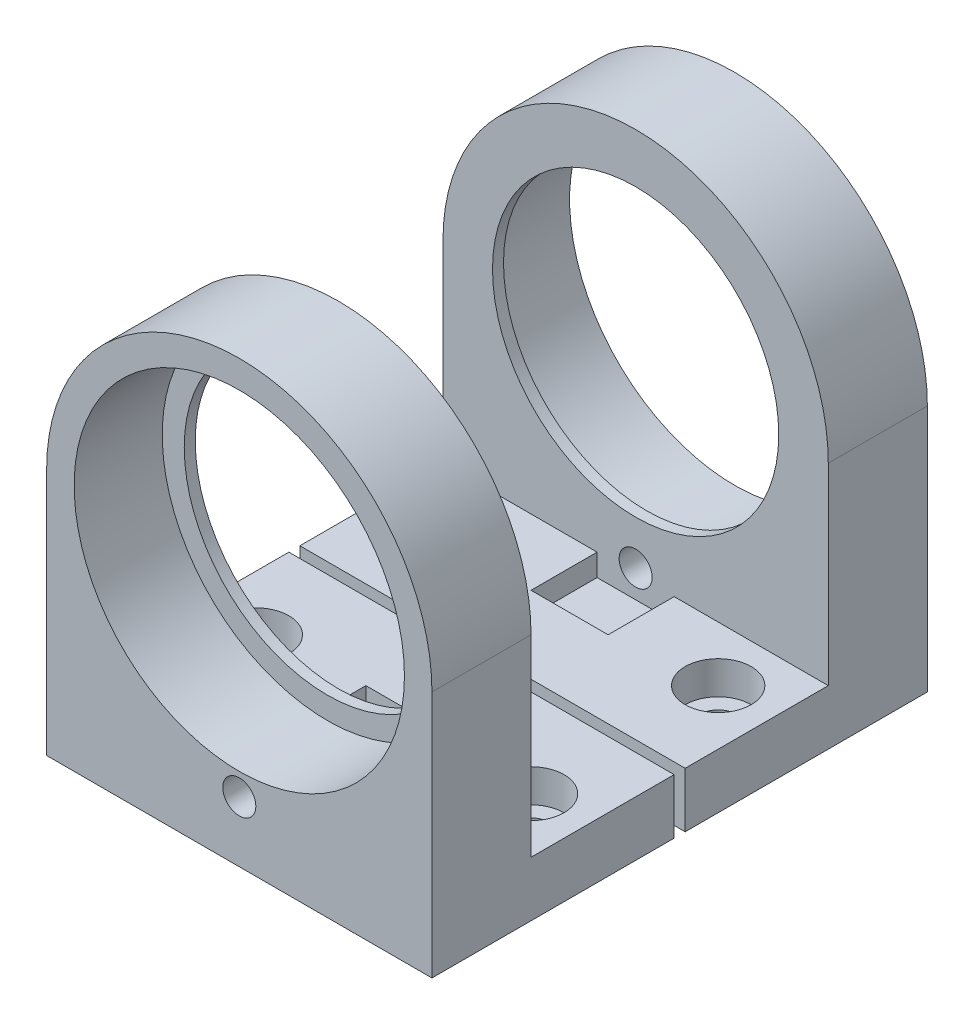
from build123d import *

# Parameters (mm, degrees)
EXTRUDE_1_DEPTH          = 17.5
CUT_EXTRUDE_1_DEPTH      = 63.69968102
CUT_EXTRUDE_1_DEPTH_BACK = 63.69968102
SKETCH_6_R               = 1.55
CUT_EXTRUDE_4_DEPTH      = 46.138675213
SKETCH_7_R               = 15
CUT_EXTRUDE_5_DEPTH      = 8
SKETCH_8_R               = 13
CUT_EXTRUDE_6_DEPTH      = 2
SKETCH_9_R               = 1.5
CUT_EXTRUDE_7_DEPTH      = 14
SKETCH_10_W              = 7
SKETCH_10_H              = 6
CUT_EXTRUDE_8_DEPTH      = 2
SKETCH_15_W              = 35
SKETCH_15_H              = 1
CUT_EXTRUDE_9_DEPTH      = 10
SKETCH_16_R              = 3
CUT_EXTRUDE_10_DEPTH     = 3


with BuildPart() as part:
    # 草图1 → 凸台-拉伸1 (new, symmetric)
    with BuildSketch(Plane(origin=(0, 0, 0), x_dir=(0, 0, -1), z_dir=(1, 0, 0))):
        Polygon((22.5, 0), (-22.5, 0), (-22.5, 40), (-13.5, 40), (-13.5, 5), (13.5, 5), (13.5, 40), (22.5, 40), align=None)
    extrude(amount=EXTRUDE_1_DEPTH, both=True)

    # 草图2 → 切除-拉伸1 (cut, two sides: drawn at the far end of the back side and taken through both)
    with BuildSketch(Plane.XY.offset(22.5).offset(-CUT_EXTRUDE_1_DEPTH_BACK)):
        with BuildLine():
            ThreePointArc((-17.5, 22.5), (-12.374368671, 34.874368671), (0, 40))
            Line((0, 40), (-17.5, 40))
            Line((-17.5, 40), (-17.5, 22.5))
        make_face()
        with BuildLine():
            Line((17.5, 22.5), (17.5, 40))
            Line((17.5, 40), (0, 40))
            ThreePointArc((0, 40), (12.374368671, 34.874368671), (17.5, 22.5))
        make_face()
    extrude(amount=CUT_EXTRUDE_1_DEPTH + CUT_EXTRUDE_1_DEPTH_BACK, mode=Mode.SUBTRACT)

    # 草图6 → 切除-拉伸4 (cut, through all)
    with BuildSketch(Plane(origin=(0, 5, 0), x_dir=(1, 0, 0), z_dir=(0, 1, 0))):
        with Locations(Location((-12.5, 8.5, 0), (0, 0, 270))):
            Circle(SKETCH_6_R)
        with Locations(Location((12.5, 8.5, 0), (0, 0, 90))):
            Circle(SKETCH_6_R)
        with Locations(Location((12.5, -8.5, 0), (0, 0, 270))):
            Circle(SKETCH_6_R)
        with Locations(Location((-12.5, -8.5, 0), (0, 0, 90))):
            Circle(SKETCH_6_R)
    extrude(amount=-CUT_EXTRUDE_4_DEPTH, mode=Mode.SUBTRACT)

    # 草图7 → 切除-拉伸5 (cut)
    with BuildSketch(Plane.XY.offset(22.5)):
        with Locations((0, 22.5)):
            Circle(SKETCH_7_R)
    cut_extrude_5 = extrude(amount=-CUT_EXTRUDE_5_DEPTH, mode=Mode.SUBTRACT)

    # 草图8 → 切除-拉伸6 (cut)
    with BuildSketch(Plane.XY.offset(14.5)):
        with Locations((0, 22.5)):
            Circle(SKETCH_8_R)
    cut_extrude_6 = extrude(amount=-CUT_EXTRUDE_6_DEPTH, mode=Mode.SUBTRACT)

    # 镜向1: 切除-拉伸5, 切除-拉伸6 across plane
    add(cut_extrude_5.mirror(Plane.XY), mode=Mode.SUBTRACT)
    add(cut_extrude_6.mirror(Plane.XY), mode=Mode.SUBTRACT)

    # 草图9 → 切除-拉伸7 (cut)
    with BuildSketch(Plane(origin=(0, 0, -22.5), x_dir=(-1, 0, 0), z_dir=(0, 0, -1))):
        with Locations(Location((0, 5.5, 0), (0, 0, 90))):
            Circle(SKETCH_9_R)
    cut_extrude_7 = extrude(amount=-CUT_EXTRUDE_7_DEPTH, mode=Mode.SUBTRACT)

    # 草图10 → 切除-拉伸8 (cut)
    with BuildSketch(Plane(origin=(0, 5, 0), x_dir=(1, 0, 0), z_dir=(0, 1, 0))):
        with Locations((0, 10.5)):
            Rectangle(SKETCH_10_W, SKETCH_10_H)
    cut_extrude_8 = extrude(amount=-CUT_EXTRUDE_8_DEPTH, mode=Mode.SUBTRACT)

    # 镜向2: 切除-拉伸7, 切除-拉伸8 across plane
    add(cut_extrude_7.mirror(Plane.XY), mode=Mode.SUBTRACT)
    add(cut_extrude_8.mirror(Plane.XY), mode=Mode.SUBTRACT)

    # 草图15 → 切除-拉伸9 (cut)
    with BuildSketch(Plane(origin=(0, 5, 0), x_dir=(1, 0, 0), z_dir=(0, 1, 0))):
        Rectangle(SKETCH_15_W, SKETCH_15_H)
    extrude(amount=-CUT_EXTRUDE_9_DEPTH, mode=Mode.SUBTRACT)


with BuildPart() as cut_extrude_9_piece_1:
    # of the separate pieces the step leaves, piece 1, a body of its own (cut_extrude_9_pieces)
    add(part.part.solids().sort_by_distance((-17.5, 0, -22.5))[0])


with BuildPart() as cut_extrude_9_piece_2:
    # of the separate pieces the step leaves, piece 2, a body of its own (cut_extrude_9_pieces)
    add(part.part.solids().sort_by_distance((17.5, 0, 0.5))[0])


with BuildPart() as cut_extrude_10_tool:
    # 草图16 → 切除-拉伸10 (new body)
    with BuildSketch(Plane(origin=(0, 5, 0), x_dir=(1, 0, 0), z_dir=(0, 1, 0))):
        with Locations(Location((-12.5, 8.5, 0), (0, 0, 270))):
            Circle(SKETCH_16_R)
        with Locations(Location((12.5, 8.5, 0), (0, 0, 270))):
            Circle(SKETCH_16_R)
        with Locations(Location((12.5, -8.5, 0), (0, 0, 270))):
            Circle(SKETCH_16_R)
        with Locations(Location((-12.5, -8.5, 0), (0, 0, 270))):
            Circle(SKETCH_16_R)
    extrude(amount=-CUT_EXTRUDE_10_DEPTH)


with BuildPart() as cut_extrude_9_piece_1_1:
    add(cut_extrude_9_piece_1.part)

    # 切除-拉伸10: cut by cut_extrude_10_tool
    add(cut_extrude_10_tool.part, mode=Mode.SUBTRACT)


with BuildPart() as cut_extrude_9_piece_2_1:
    add(cut_extrude_9_piece_2.part)

    # 切除-拉伸10: cut by cut_extrude_10_tool
    add(cut_extrude_10_tool.part, mode=Mode.SUBTRACT)


solid = Compound([cut_extrude_9_piece_1_1.part, cut_extrude_9_piece_2_1.part])
